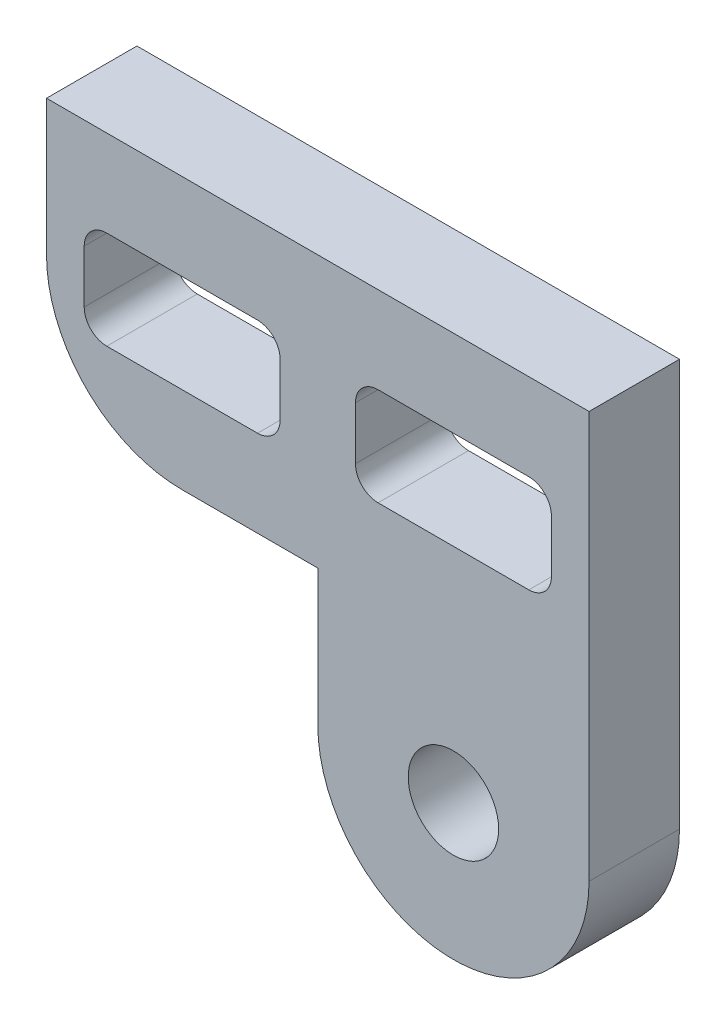
from build123d import *

# Parameters (mm, degrees)
MODEL_R                 = 1.5
SALIENTE_EXTRUIR1_DEPTH = 3


with BuildPart() as part:
    # Model → Saliente-Extruir1 (new body)
    with BuildSketch(Plane.XY):
        with BuildLine():
            Line((149.34213351, 211.823953209), (158.34213351, 211.823953209))
            Line((158.34213351, 211.823953209), (162.84213351, 211.823953209))
            Line((162.84213351, 211.823953209), (162.84213351, 198.323953209))
            ThreePointArc((162.84213351, 198.323953209), (158.34213351, 193.823953209), (153.84213351, 198.323953209))
            Line((153.84213351, 198.323953209), (153.84213351, 202.823953209))
            Line((153.84213351, 202.823953209), (149.34213351, 202.823953209))
            ThreePointArc((149.34213351, 202.823953209), (146.160152994, 204.141972694), (144.84213351, 207.323953209))
            Line((144.84213351, 207.323953209), (144.84213351, 211.823953209))
            Line((144.84213351, 211.823953209), (149.34213351, 211.823953209))
        make_face()
        with Locations((158.34213351, 198.323953209)):
            Circle(MODEL_R, mode=Mode.SUBTRACT)
        with BuildLine():
            Line((151.84213351, 205.698953209), (146.84213351, 205.698953209))
            ThreePointArc((146.84213351, 205.698953209), (146.311803424, 205.918623123), (146.09213351, 206.448953209))
            Line((146.09213351, 206.448953209), (146.09213351, 208.198953209))
            ThreePointArc((146.09213351, 208.198953209), (146.311803424, 208.729283295), (146.84213351, 208.948953209))
            Line((146.84213351, 208.948953209), (151.84213351, 208.948953209))
            ThreePointArc((151.84213351, 208.948953209), (152.372463595, 208.729283295), (152.59213351, 208.198953209))
            Line((152.59213351, 208.198953209), (152.59213351, 206.448953209))
            ThreePointArc((152.59213351, 206.448953209), (152.372463595, 205.918623123), (151.84213351, 205.698953209))
        make_face(mode=Mode.SUBTRACT)
        with BuildLine():
            Line((160.84213351, 205.698953209), (155.84213351, 205.698953209))
            ThreePointArc((155.84213351, 205.698953209), (155.311803424, 205.918623123), (155.09213351, 206.448953209))
            Line((155.09213351, 206.448953209), (155.09213351, 208.198953209))
            ThreePointArc((155.09213351, 208.198953209), (155.311803424, 208.729283295), (155.84213351, 208.948953209))
            Line((155.84213351, 208.948953209), (160.84213351, 208.948953209))
            ThreePointArc((160.84213351, 208.948953209), (161.372463595, 208.729283295), (161.59213351, 208.198953209))
            Line((161.59213351, 208.198953209), (161.59213351, 206.448953209))
            ThreePointArc((161.59213351, 206.448953209), (161.372463595, 205.918623123), (160.84213351, 205.698953209))
        make_face(mode=Mode.SUBTRACT)
    extrude(amount=SALIENTE_EXTRUIR1_DEPTH)


solid = part.part
